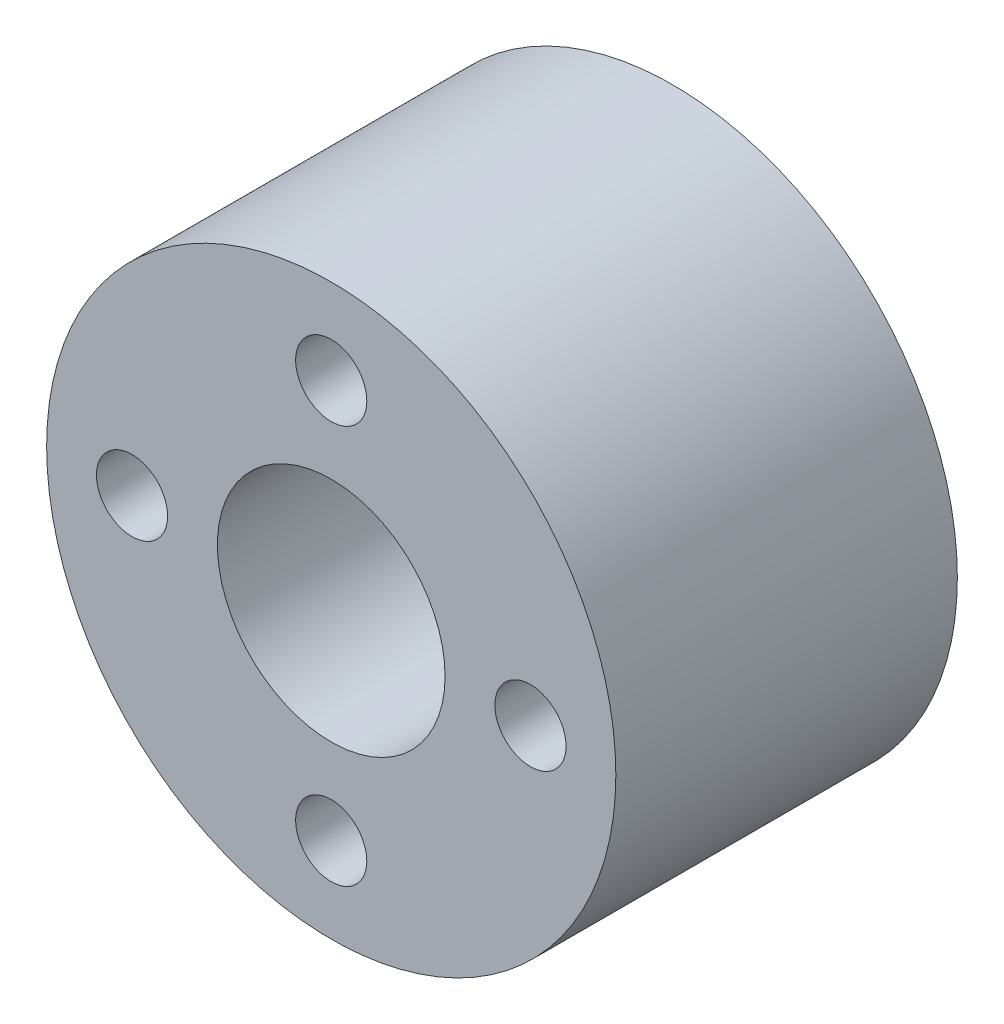
from build123d import *

# Parameters (mm, degrees)
SKETCH_1_R      = 10
SKETCH_1_R_2    = 4
SKETCH_1_R_3    = 1.25
EXTRUDE_1_DEPTH = 12


with BuildPart() as part:
    # 草图1 → 凸台-拉伸1 (new body)
    with BuildSketch(Plane.XY):
        Circle(SKETCH_1_R)
        Circle(SKETCH_1_R_2, mode=Mode.SUBTRACT)
        with Locations((7, 0)):
            Circle(SKETCH_1_R_3, mode=Mode.SUBTRACT)
        with Locations((0, -7)):
            Circle(SKETCH_1_R_3, mode=Mode.SUBTRACT)
        with Locations((-7, 0)):
            Circle(SKETCH_1_R_3, mode=Mode.SUBTRACT)
        with Locations((0, 7)):
            Circle(SKETCH_1_R_3, mode=Mode.SUBTRACT)
    extrude(amount=EXTRUDE_1_DEPTH)


solid = part.part
